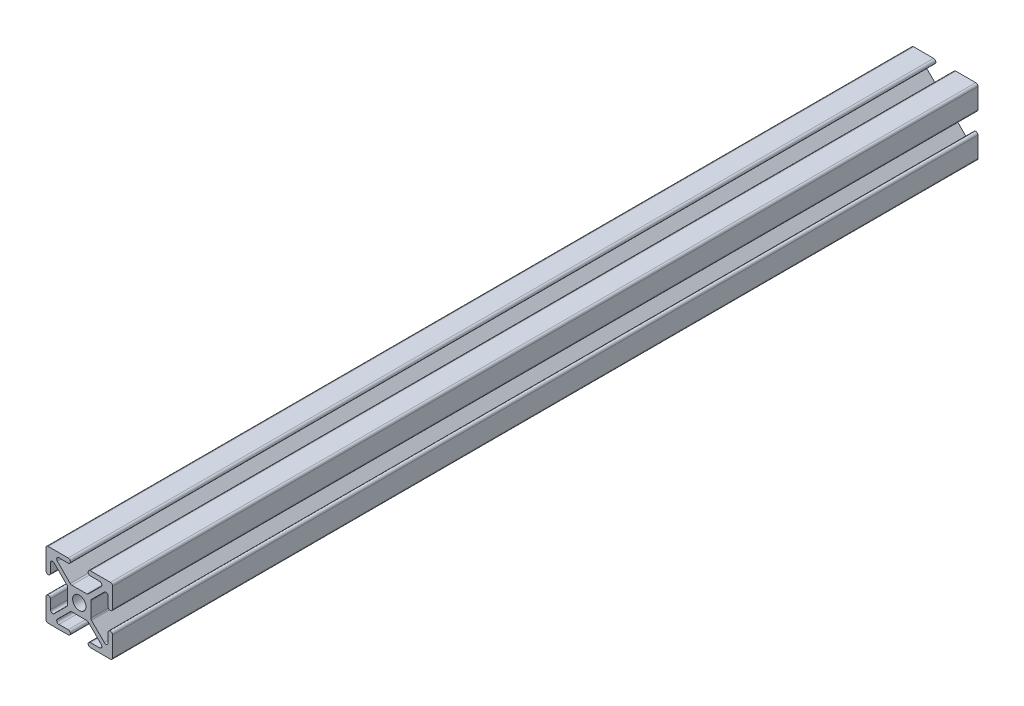
from build123d import *

# Parameters (mm, degrees)
SALIENTE_EXTRUIR1_DEPTH = 390
CROQUIS2_R              = 3
CORTAR_EXTRUIR1_DEPTH   = 391.576496989
CORTAR_EXTRUIR3_DEPTH   = 391.576496989


with BuildPart() as part:
    # Croquis1 → Saliente-Extruir1 (new body)
    with BuildSketch(Plane.XY):
        with BuildLine():
            Line((-14, 15), (14, 15))
            ThreePointArc((14, 15), (14.707106781, 14.707106781), (15, 14))
            Line((15, 14), (15, -14))
            ThreePointArc((15, -14), (14.707106781, -14.707106781), (14, -15))
            Line((14, -15), (-14, -15))
            ThreePointArc((-14, -15), (-14.707106781, -14.707106781), (-15, -14))
            Line((-15, -14), (-15, 14))
            ThreePointArc((-15, 14), (-14.707106781, 14.707106781), (-14, 15))
        make_face()
    extrude(amount=-SALIENTE_EXTRUIR1_DEPTH)

    # Croquis2 → Cortar-Extruir1 (cut, through all)
    with BuildSketch(Plane.XY):
        Circle(CROQUIS2_R)
    extrude(amount=-CORTAR_EXTRUIR1_DEPTH, mode=Mode.SUBTRACT)

    # Croquis3 → Cortar-Extruir3 (cut, through all)
    with BuildSketch(Plane.XY):
        with BuildLine():
            Line((-5.492893219, 4.078679656), (-11.292893219, 9.878679656))
            ThreePointArc((-11.292893219, 9.878679656), (-12.382683432, 10.095452408), (-13, 9.171572875))
            Line((-13, 9.171572875), (-13, 5))
            ThreePointArc((-13, 5), (-14, 4), (-15, 5))
            Line((-15, 5), (-15, -5))
            ThreePointArc((-15, -5), (-14, -4), (-13, -5))
            Line((-13, -5), (-13, -9.171572875))
            ThreePointArc((-13, -9.171572875), (-12.382683432, -10.095452408), (-11.292893219, -9.878679656))
            Line((-11.292893219, -9.878679656), (-5.492893219, -4.078679656))
            ThreePointArc((-5.492893219, -4.078679656), (-5.276120467, -3.754256308), (-5.2, -3.371572875))
            Line((-5.2, -3.371572875), (-5.2, 3.371572875))
            ThreePointArc((-5.2, 3.371572875), (-5.276120467, 3.754256308), (-5.492893219, 4.078679656))
        make_face()
        with BuildLine():
            ThreePointArc((-9.171572875, 13), (-10.095452408, 12.382683432), (-9.878679656, 11.292893219))
            Line((-9.878679656, 11.292893219), (-4.078679656, 5.492893219))
            ThreePointArc((-4.078679656, 5.492893219), (-3.754256308, 5.276120467), (-3.371572875, 5.2))
            Line((-3.371572875, 5.2), (3.371572875, 5.2))
            ThreePointArc((3.371572875, 5.2), (3.754256308, 5.276120467), (4.078679656, 5.492893219))
            Line((4.078679656, 5.492893219), (9.878679656, 11.292893219))
            ThreePointArc((9.878679656, 11.292893219), (10.095452408, 12.382683432), (9.171572875, 13))
            Line((9.171572875, 13), (5, 13))
            ThreePointArc((5, 13), (4, 14), (5, 15))
            Line((5, 15), (-5, 15))
            ThreePointArc((-5, 15), (-4.292893219, 14.707106781), (-4, 14))
            ThreePointArc((-4, 14), (-4.292893219, 13.292893219), (-5, 13))
            Line((-5, 13), (-9.171572875, 13))
        make_face()
        with BuildLine():
            Line((9.878679656, -11.292893219), (4.078679656, -5.492893219))
            ThreePointArc((4.078679656, -5.492893219), (3.754256308, -5.276120467), (3.371572875, -5.2))
            Line((3.371572875, -5.2), (-3.371572875, -5.2))
            ThreePointArc((-3.371572875, -5.2), (-3.754256308, -5.276120467), (-4.078679656, -5.492893219))
            Line((-4.078679656, -5.492893219), (-9.878679656, -11.292893219))
            ThreePointArc((-9.878679656, -11.292893219), (-10.095452408, -12.382683432), (-9.171572875, -13))
            Line((-9.171572875, -13), (-5, -13))
            ThreePointArc((-5, -13), (-4.292893219, -13.292893219), (-4, -14))
            ThreePointArc((-4, -14), (-4.292893219, -14.707106781), (-5, -15))
            Line((-5, -15), (5, -15))
            ThreePointArc((5, -15), (4, -14), (5, -13))
            Line((5, -13), (9.171572875, -13))
            ThreePointArc((9.171572875, -13), (10.095452408, -12.382683432), (9.878679656, -11.292893219))
        make_face()
        with BuildLine():
            ThreePointArc((13, 9.171572875), (12.382683432, 10.095452408), (11.292893219, 9.878679656))
            Line((11.292893219, 9.878679656), (5.492893219, 4.078679656))
            ThreePointArc((5.492893219, 4.078679656), (5.276120467, 3.754256308), (5.2, 3.371572875))
            Line((5.2, 3.371572875), (5.2, -3.371572875))
            ThreePointArc((5.2, -3.371572875), (5.276120467, -3.754256308), (5.492893219, -4.078679656))
            Line((5.492893219, -4.078679656), (11.292893219, -9.878679656))
            ThreePointArc((11.292893219, -9.878679656), (12.382683432, -10.095452408), (13, -9.171572875))
            Line((13, -9.171572875), (13, -5))
            ThreePointArc((13, -5), (14, -4), (15, -5))
            Line((15, -5), (15, 5))
            ThreePointArc((15, 5), (14, 4), (13, 5))
            Line((13, 5), (13, 9.171572875))
        make_face()
    extrude(amount=-CORTAR_EXTRUIR3_DEPTH, mode=Mode.SUBTRACT)


solid = part.part
